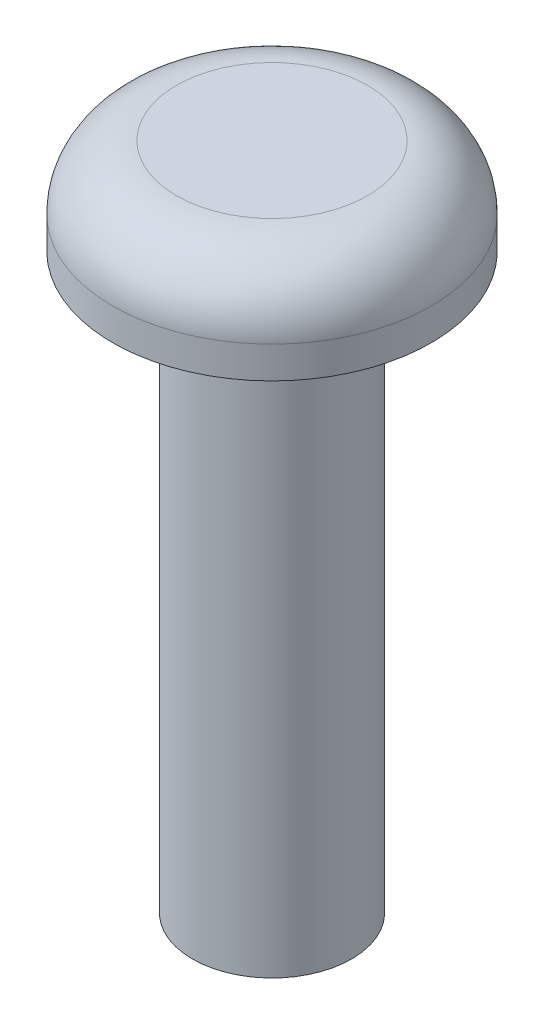
from build123d import *

# Parameters (mm, degrees)
SKETCH1_R           = 0.635
BOSS_EXTRUDE1_DEPTH = 4.572
SKETCH2_R           = 1.27
BOSS_EXTRUDE2_DEPTH = 0.762
FILLET1_R           = 0.508


with BuildPart() as part:
    # Sketch1 → Boss-Extrude1 (new body)
    with BuildSketch(Plane(origin=(0, 0, 0), x_dir=(1, 0, 0), z_dir=(0, 1, 0))):
        with Locations(Location((0, 0, 0), (0, 0, 270))):
            Circle(SKETCH1_R)
    extrude(amount=BOSS_EXTRUDE1_DEPTH)

    # Sketch2 → Boss-Extrude2 (add)
    with BuildSketch(Plane(origin=(0, 4.572, 0), x_dir=(1, 0, 0), z_dir=(0, 1, 0))):
        with Locations(Location((0, 0, 0), (0, 0, 90))):
            Circle(SKETCH2_R)
    extrude(amount=BOSS_EXTRUDE2_DEPTH)

    # Fillet1
    fillet1_edges = [part.edges().sort_by_distance(p)[0] for p in [
        (0, 5.334, 1.27),
    ]]
    fillet(fillet1_edges, radius=FILLET1_R)


solid = part.part
